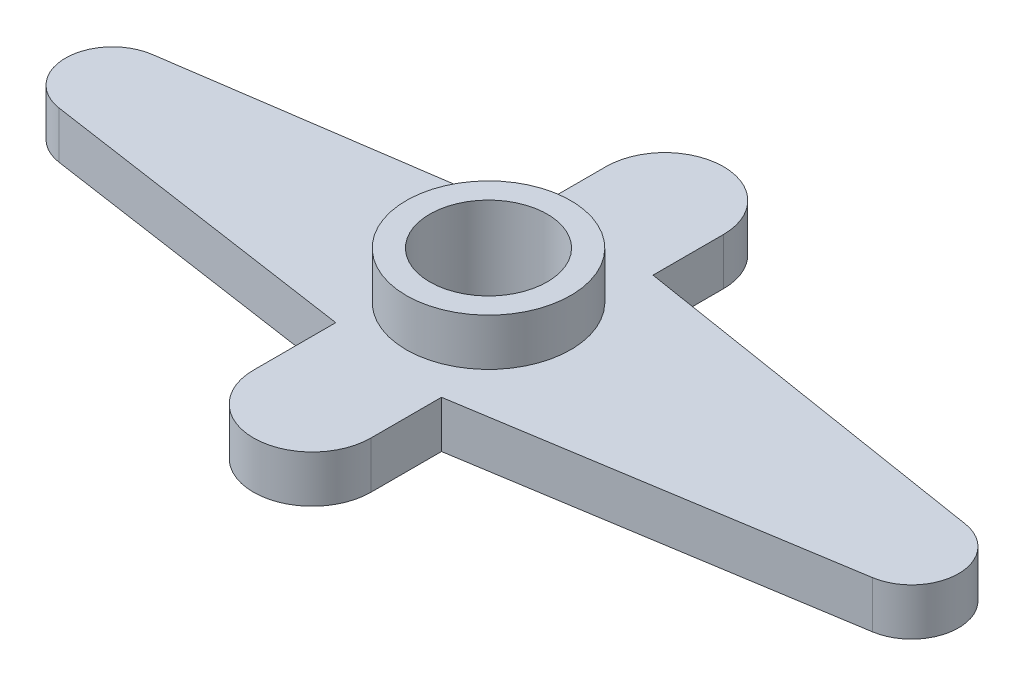
from build123d import *

# Parameters (mm, degrees)
SKETCH1_R           = 3.5
SKETCH1_R_2         = 2.5
BOSS_EXTRUDE1_DEPTH = 4
BOSS_EXTRUDE2_DEPTH = 2


with BuildPart() as part:
    # Sketch1 → Boss-Extrude1 (new body)
    with BuildSketch(Plane(origin=(0, 0, 0), x_dir=(1, 0, 0), z_dir=(0, 1, 0))):
        with Locations(Location((0, 0, 0), (0, 0, 270))):
            Circle(SKETCH1_R)
        with Locations(Location((0, 0, 0), (0, 0, 270))):
            Circle(SKETCH1_R_2, mode=Mode.SUBTRACT)
    extrude(amount=BOSS_EXTRUDE1_DEPTH)

    # Sketch2 → Boss-Extrude2 (add)
    with BuildSketch(Plane(origin=(0, 0, 0), x_dir=(1, 0, 0), z_dir=(0, 1, 0))):
        with BuildLine():
            Line((-2.5, 2.449489743), (-2.5, 7.5))
            ThreePointArc((-2.5, 7.5), (0, 10), (2.5, 7.5))
            Line((2.5, 7.5), (2.5, 2.449489743))
            ThreePointArc((2.5, 2.449489743), (0, 3.5), (-2.5, 2.449489743))
        make_face()
        with BuildLine():
            Line((2.5, 4.5), (2.5, 0))
            Line((2.5, 0), (2.5, -4.5))
            Line((2.5, -4.5), (18.315318835, -1.974987097))
            ThreePointArc((18.315318835, -1.974987097), (20, 0), (18.315318835, 1.974987097))
            Line((18.315318835, 1.974987097), (2.5, 4.5))
        make_face()
        with BuildLine():
            Line((-2.5, -2.449489743), (-2.5, -7.5))
            ThreePointArc((-2.5, -7.5), (0, -10), (2.5, -7.5))
            Line((2.5, -7.5), (2.5, -2.449489743))
            ThreePointArc((2.5, -2.449489743), (0, -3.5), (-2.5, -2.449489743))
        make_face()
        with BuildLine():
            Line((-2.5, -4), (-2.5, 0))
            Line((-2.5, 0), (-2.5, 4))
            Line((-2.5, 4), (-16.290032176, 1.978858594))
            ThreePointArc((-16.290032176, 1.978858594), (-18, 0), (-16.290032176, -1.978858594))
            Line((-16.290032176, -1.978858594), (-2.5, -4))
        make_face()
    extrude(amount=BOSS_EXTRUDE2_DEPTH)


solid = part.part
